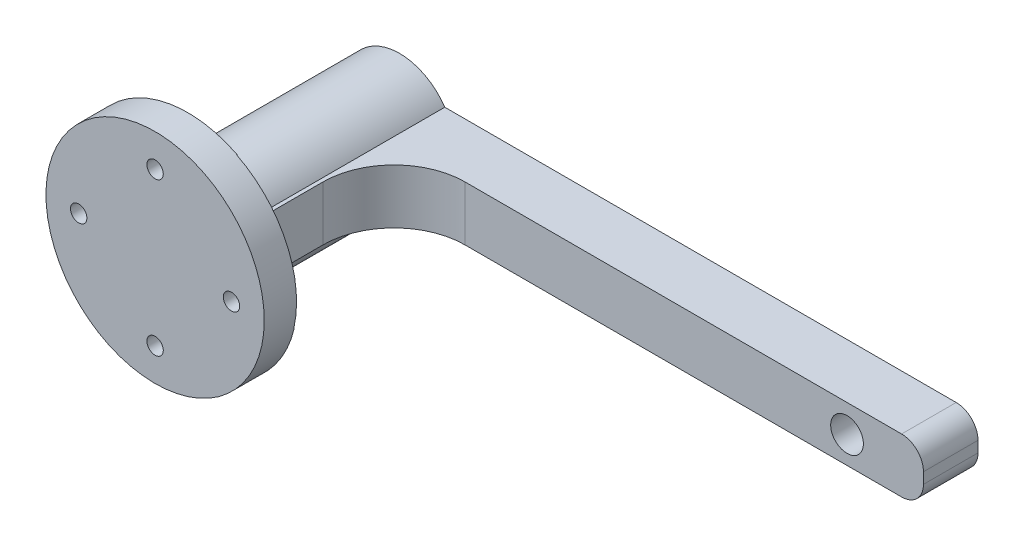
from build123d import *

# Parameters (mm, degrees)
SKETCH_1_R          = 10
EXTRUDE_1_DEPTH     = 3
SKETCH_2_R          = 0.75
CUT_EXTRUDE_1_DEPTH = 15.456832295
SKETCH_3_R          = 5
EXTRUDE_2_DEPTH     = 19.4
SKETCH_6_W          = 19.4
SKETCH_6_H          = 5
EXTRUDE_4_DEPTH     = 53
CUT_EXTRUDE_2_DEPTH = 58.742788457
SKETCH_8_R          = 1.5
CUT_EXTRUDE_3_DEPTH = 59.401712304
FILLET_1_R          = 2


with BuildPart() as part:
    # 草图1 → 凸台-拉伸1 (new body)
    with BuildSketch(Plane.XY):
        Circle(SKETCH_1_R)
    extrude(amount=EXTRUDE_1_DEPTH)

    # 草图2 → 切除-拉伸1 (cut, through all)
    with BuildSketch(Plane(origin=(0, 0, 0), x_dir=(-1, 0, 0), z_dir=(0, 0, -1))):
        with Locations((0, 7)):
            Circle(SKETCH_2_R)
        with Locations((7, 0)):
            Circle(SKETCH_2_R)
        with Locations((0, -7)):
            Circle(SKETCH_2_R)
        with Locations((-7, 0)):
            Circle(SKETCH_2_R)
    extrude(amount=-CUT_EXTRUDE_1_DEPTH, mode=Mode.SUBTRACT)

    # 草图3 → 凸台-拉伸2 (add)
    with BuildSketch(Plane(origin=(0, 0, 0), x_dir=(-1, 0, 0), z_dir=(0, 0, -1))):
        with Locations(Location((0, 0, 0), (0, 0, 180))):
            Circle(SKETCH_3_R)
    extrude(amount=EXTRUDE_2_DEPTH)

    # 草图6 → 凸台-拉伸4 (add)
    with BuildSketch(Plane(origin=(0, 0, 0), x_dir=(0, 0, -1), z_dir=(1, 0, 0))):
        with Locations((9.7, 0.298786174)):
            Rectangle(SKETCH_6_W, SKETCH_6_H)
    extrude(amount=EXTRUDE_4_DEPTH)

    # 草图7 → 切除-拉伸2 (cut, through all)
    with BuildSketch(Plane(origin=(0, -2.201213826, 0), x_dir=(-1, 0, 0), z_dir=(0, -1, 0))):
        with BuildLine():
            Line((-4.489393911, -0.038773437), (-53, -0.038773437))
            Line((-53, -0.038773437), (-53, 14.4))
            Line((-53, 14.4), (-10.989393911, 14.4))
            ThreePointArc((-10.989393911, 14.4), (-6.393199834, 12.496194078), (-4.489393911, 7.9))
            Line((-4.489393911, 7.9), (-4.489393911, -0.038773437))
        make_face()
    extrude(amount=-CUT_EXTRUDE_2_DEPTH, mode=Mode.SUBTRACT)

    # 草图8 → 切除-拉伸3 (cut, through all)
    with BuildSketch(Plane(origin=(0, 0, -19.4), x_dir=(-1, 0, 0), z_dir=(0, 0, -1))):
        with Locations((-46, 0.261084443)):
            Circle(SKETCH_8_R)
    extrude(amount=-CUT_EXTRUDE_3_DEPTH, mode=Mode.SUBTRACT)

    # 圆角1
    fillet_1_edges = [part.edges().sort_by_distance(p)[0] for p in [
        (53, 2.798786174, -16.9),
        (53, -2.201213826, -16.9),
    ]]
    fillet(fillet_1_edges, radius=FILLET_1_R)


solid = part.part
